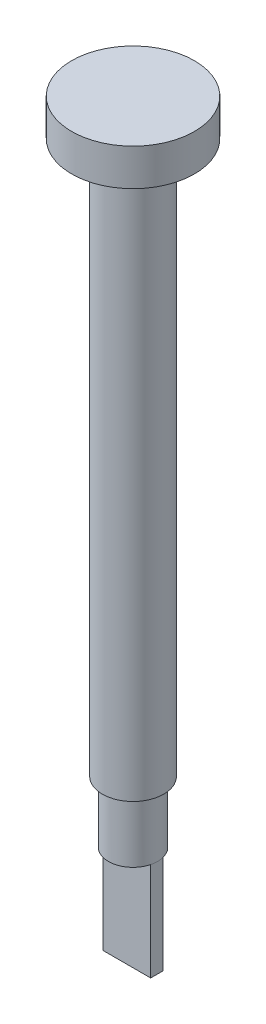
from build123d import *

# Parameters (mm, degrees)
SKETCH4_W           = 3.872983346
SKETCH4_H           = 1
BOSS_EXTRUDE1_DEPTH = 8


with BuildPart() as part:
    # Sketch2 → Revolve1 (revolve)
    with BuildSketch(Plane.XY, mode=Mode.PRIVATE) as revolve1_sk:
        Polygon((0, 0), (0, 50), (0, 53), (5, 53), (5, 50), (2.5, 50), (2.5, 5), (2, 5), (2, 0), align=None)
    revolve(revolve1_sk.sketch.rotate(Axis((0, 0, 0), (0, 1, 0)), 90), axis=Axis((0, 0, 0), (0, 1, 0)))

    # Sketch4 → Boss-Extrude1 (add)
    with BuildSketch(Plane.XZ):
        Rectangle(SKETCH4_W, SKETCH4_H)
    extrude(amount=BOSS_EXTRUDE1_DEPTH)


solid = part.part
